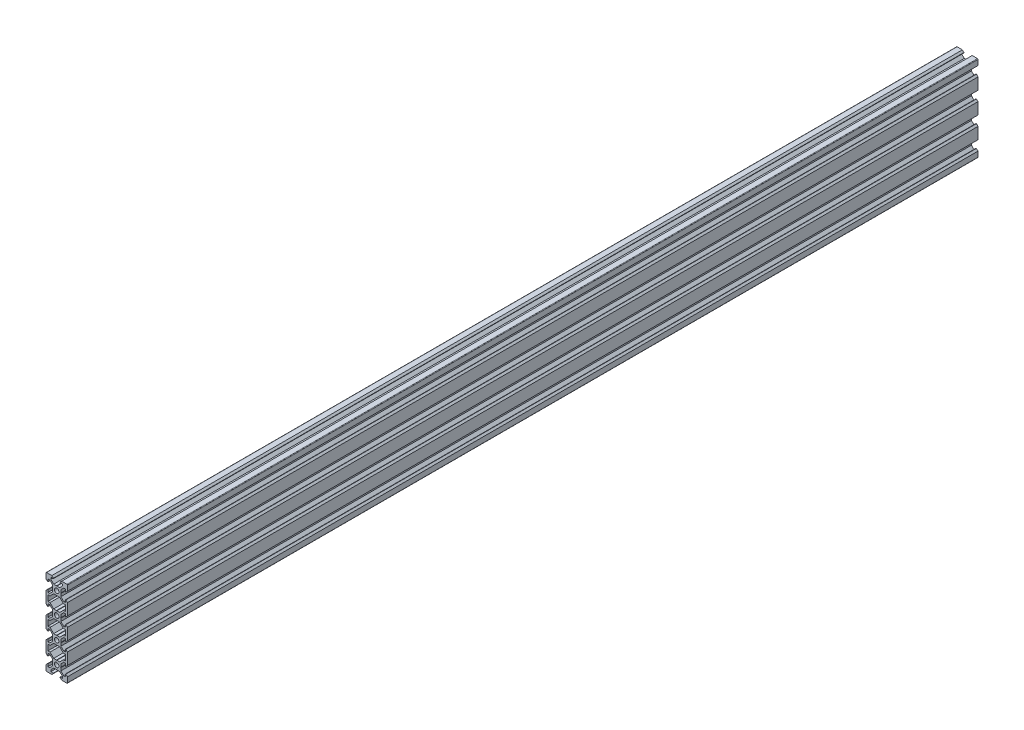
from build123d import *

# Parameters (mm, degrees)
BOSS_EXTRU_1_DEPTH = 850


with BuildPart() as part:
    # Esquisse1 → Boss.-Extru.1 (new body)
    with BuildSketch(Plane.XY):
        with BuildLine():
            Line((-9.5, 10), (-4.58, 10))
            Line((-4.58, 10), (-3.125, 8.545))
            Line((-3.125, 8.545), (-3.125, 8.2))
            Line((-3.125, 8.2), (-5.5, 8.2))
            Line((-5.5, 8.2), (-5.5, 6.560660172))
            Line((-5.5, 6.560660172), (-2.839339828, 3.9))
            Line((-2.839339828, 3.9), (-0.21, 3.9))
            Line((-0.21, 3.9), (0, 3.69))
            Line((0, 3.69), (0, 2.1))
            ThreePointArc((0, 2.1), (-2.1, 0), (0, -2.1))
            Line((0, -2.1), (0, -3.69))
            Line((0, -3.69), (-0.21, -3.9))
            Line((-0.21, -3.9), (-2.839339828, -3.9))
            Line((-2.839339828, -3.9), (-6.239339828, -7.3))
            Line((-6.239339828, -7.3), (-8.2, -7.3))
            Line((-8.2, -7.3), (-8.2, -12.7))
            Line((-8.2, -12.7), (-6.239339828, -12.7))
            Line((-6.239339828, -12.7), (-2.839339828, -16.1))
            Line((-2.839339828, -16.1), (-0.21, -16.1))
            Line((-0.21, -16.1), (0, -16.31))
            Line((0, -16.31), (0, -17.9))
            ThreePointArc((0, -17.9), (-2.1, -20), (0, -22.1))
            Line((0, -22.1), (0, -23.69))
            Line((0, -23.69), (-0.21, -23.9))
            Line((-0.21, -23.9), (-2.839339828, -23.9))
            Line((-2.839339828, -23.9), (-6.239339828, -27.3))
            Line((-6.239339828, -27.3), (-8.2, -27.3))
            Line((-8.2, -27.3), (-8.2, -32.7))
            Line((-8.2, -32.7), (-6.239339828, -32.7))
            Line((-6.239339828, -32.7), (-2.839339828, -36.1))
            Line((-2.839339828, -36.1), (-0.21, -36.1))
            Line((-0.21, -36.1), (0, -36.31))
            Line((0, -36.31), (0, -37.9))
            ThreePointArc((0, -37.9), (-2.1, -40), (0, -42.1))
            Line((0, -42.1), (0, -43.69))
            Line((0, -43.69), (-0.21, -43.9))
            Line((-0.21, -43.9), (-2.839339828, -43.9))
            Line((-2.839339828, -43.9), (-6.239339828, -47.3))
            Line((-6.239339828, -47.3), (-8.2, -47.3))
            Line((-8.2, -47.3), (-8.2, -52.7))
            Line((-8.2, -52.7), (-6.239339828, -52.7))
            Line((-6.239339828, -52.7), (-2.839339828, -56.1))
            Line((-2.839339828, -56.1), (-0.21, -56.1))
            Line((-0.21, -56.1), (0, -56.31))
            Line((0, -56.31), (0, -57.9))
            ThreePointArc((0, -57.9), (-2.1, -60), (0, -62.1))
            Line((0, -62.1), (0, -63.69))
            Line((0, -63.69), (-0.21, -63.9))
            Line((-0.21, -63.9), (-2.839339828, -63.9))
            Line((-2.839339828, -63.9), (-5.5, -66.560660172))
            Line((-5.5, -66.560660172), (-5.5, -68.2))
            Line((-5.5, -68.2), (-3.125, -68.2))
            Line((-3.125, -68.2), (-3.125, -68.545))
            Line((-3.125, -68.545), (-4.58, -70))
            Line((-4.58, -70), (-9.5, -70))
            ThreePointArc((-9.5, -70), (-9.853553391, -69.853553391), (-10, -69.5))
            Line((-10, -69.5), (-10, -64.58))
            Line((-10, -64.58), (-8.545, -63.125))
            Line((-8.545, -63.125), (-8.2, -63.125))
            Line((-8.2, -63.125), (-8.2, -65.5))
            Line((-8.2, -65.5), (-6.560660172, -65.5))
            Line((-6.560660172, -65.5), (-3.9, -62.839339828))
            Line((-3.9, -62.839339828), (-3.9, -60.21))
            Line((-3.9, -60.21), (-3.69, -60))
            Line((-3.69, -60), (-3.9, -59.79))
            Line((-3.9, -59.79), (-3.9, -57.160660172))
            Line((-3.9, -57.160660172), (-6.560660172, -54.5))
            Line((-6.560660172, -54.5), (-8.2, -54.5))
            Line((-8.2, -54.5), (-8.2, -56.875))
            Line((-8.2, -56.875), (-8.545, -56.875))
            Line((-8.545, -56.875), (-10, -55.42))
            Line((-10, -55.42), (-10, -44.58))
            Line((-10, -44.58), (-8.545, -43.125))
            Line((-8.545, -43.125), (-8.2, -43.125))
            Line((-8.2, -43.125), (-8.2, -45.5))
            Line((-8.2, -45.5), (-6.560660172, -45.5))
            Line((-6.560660172, -45.5), (-3.9, -42.839339828))
            Line((-3.9, -42.839339828), (-3.9, -40.21))
            Line((-3.9, -40.21), (-3.69, -40))
            Line((-3.69, -40), (-3.9, -39.79))
            Line((-3.9, -39.79), (-3.9, -37.160660172))
            Line((-3.9, -37.160660172), (-6.560660172, -34.5))
            Line((-6.560660172, -34.5), (-8.2, -34.5))
            Line((-8.2, -34.5), (-8.2, -36.875))
            Line((-8.2, -36.875), (-8.545, -36.875))
            Line((-8.545, -36.875), (-10, -35.42))
            Line((-10, -35.42), (-10, -24.58))
            Line((-10, -24.58), (-8.545, -23.125))
            Line((-8.545, -23.125), (-8.2, -23.125))
            Line((-8.2, -23.125), (-8.2, -25.5))
            Line((-8.2, -25.5), (-6.560660172, -25.5))
            Line((-6.560660172, -25.5), (-3.9, -22.839339828))
            Line((-3.9, -22.839339828), (-3.9, -20.21))
            Line((-3.9, -20.21), (-3.69, -20))
            Line((-3.69, -20), (-3.9, -19.79))
            Line((-3.9, -19.79), (-3.9, -17.160660172))
            Line((-3.9, -17.160660172), (-6.560660172, -14.5))
            Line((-6.560660172, -14.5), (-8.2, -14.5))
            Line((-8.2, -14.5), (-8.2, -16.875))
            Line((-8.2, -16.875), (-8.545, -16.875))
            Line((-8.545, -16.875), (-10, -15.42))
            Line((-10, -15.42), (-10, -4.58))
            Line((-10, -4.58), (-8.545, -3.125))
            Line((-8.545, -3.125), (-8.2, -3.125))
            Line((-8.2, -3.125), (-8.2, -5.5))
            Line((-8.2, -5.5), (-6.560660172, -5.5))
            Line((-6.560660172, -5.5), (-3.9, -2.839339828))
            Line((-3.9, -2.839339828), (-3.9, -0.21))
            Line((-3.9, -0.21), (-3.69, 0))
            Line((-3.69, 0), (-3.9, 0.21))
            Line((-3.9, 0.21), (-3.9, 2.839339828))
            Line((-3.9, 2.839339828), (-6.560660172, 5.5))
            Line((-6.560660172, 5.5), (-8.2, 5.5))
            Line((-8.2, 5.5), (-8.2, 3.125))
            Line((-8.2, 3.125), (-8.545, 3.125))
            Line((-8.545, 3.125), (-10, 4.58))
            Line((-10, 4.58), (-10, 9.5))
            ThreePointArc((-10, 9.5), (-9.853553391, 9.853553391), (-9.5, 10))
        make_face()
    boss_extru_1 = extrude(amount=BOSS_EXTRU_1_DEPTH)

    # Symétrie1: Boss.-Extru.1 across plane
    add(boss_extru_1.mirror(Plane(origin=(0, 3.69, 850), x_dir=(0, 0, 1), z_dir=(-1, 0, 0))))


solid = part.part
